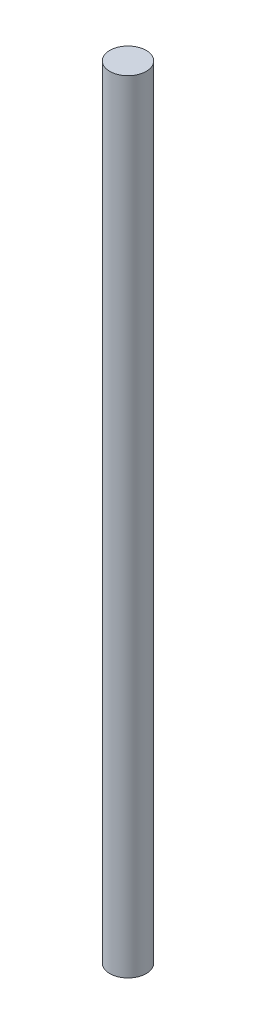
from build123d import *

# Parameters (mm, degrees)
SZKIC5_R                    = 2.4
DODANIE_WYCI_GNI_CIE2_DEPTH = 103
SZKIC6_R                    = 1.5
WYTNIJ_WYCI_GNI_CIE1_DEPTH  = 3


with BuildPart() as part:
    # Szkic5 → Dodanie-wyciągnięcie2 (new body)
    with BuildSketch(Plane(origin=(0, 0, 0), x_dir=(1, 0, 0), z_dir=(0, 1, 0))):
        with Locations(Location((2.4, 0, 0), (0, 0, 270))):
            Circle(SZKIC5_R)
    extrude(amount=DODANIE_WYCI_GNI_CIE2_DEPTH)

    # Szkic6 → Wytnij-wyciągnięcie1 (cut)
    with BuildSketch(Plane(origin=(0, 0, 0), x_dir=(0, 0, -1), z_dir=(1, 0, 0))):
        with Locations(Location((0, 2.5, 0), (0, 0, 180))):
            Circle(SZKIC6_R)
        with Locations(Location((0, 11.5, 0), (0, 0, 180))):
            Circle(SZKIC6_R)
        with Locations(Location((0, 91.5, 0), (0, 0, 180))):
            Circle(SZKIC6_R)
        with Locations(Location((0, 100.5, 0), (0, 0, 180))):
            Circle(SZKIC6_R)
    extrude(amount=WYTNIJ_WYCI_GNI_CIE1_DEPTH, mode=Mode.SUBTRACT)


solid = part.part
